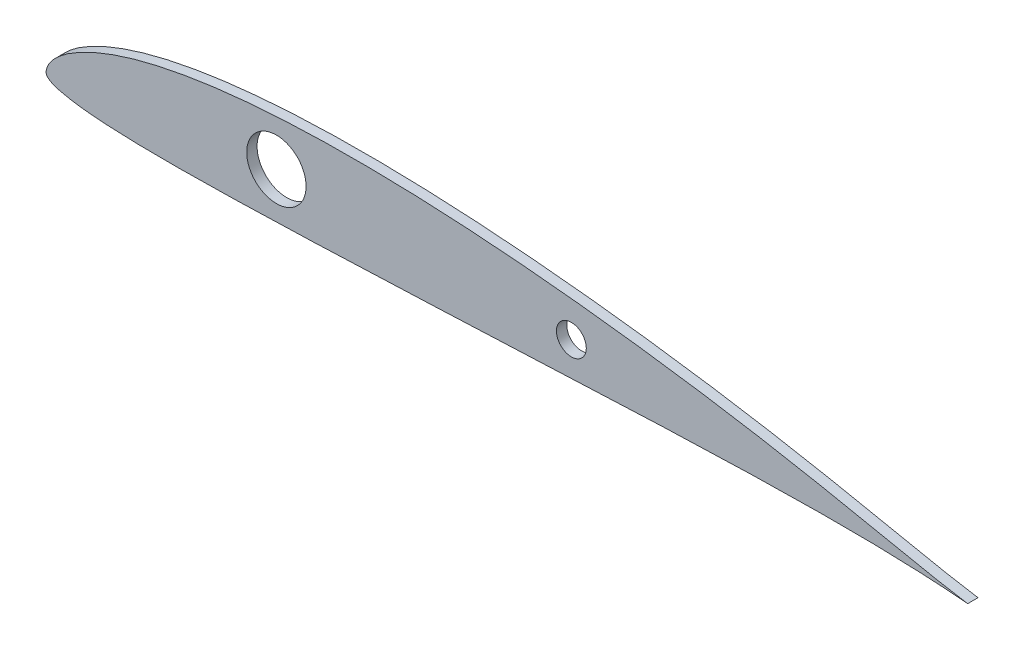
from build123d import *

# Parameters (mm, degrees)
SKETCH_1_R      = 8.05
SKETCH_1_R_2    = 4.05
EXTRUDE_1_DEPTH = 1.4


with BuildPart() as part:
    # Эскиз1 → Бобышка-Вытянуть1 (new, symmetric)
    with BuildSketch(Plane.XY):
        with BuildLine():
            add(Edge.make_bspline(
                [(0, 0), (0.018871718, -0.191458654), (0.095089169, -0.964705177), (1.706152902, -2.107027665), (4.500087477, -2.851769067), (8.687459942, -3.644061995), (14.135657503, -4.15912967), (20.848112012, -4.523549846), (28.752907792, -4.688514126), (37.779795609, -4.689041954), (47.837831161, -4.538039503), (58.820306374, -4.251921588), (70.60679251, -3.868608025), (83.06010153, -3.409033778), (96.035635701, -2.879346251), (109.387239837, -2.306383388), (122.965978931, -1.694860333), (136.622137743, -1.073639089), (150.199115392, -0.470922151), (163.53658295, 0.076551628), (176.471135172, 0.566798188), (188.841099972, 0.957639353), (200.483907746, 1.228143059), (211.234601881, 1.358189011), (220.926690721, 1.347697775), (229.39612438, 1.180923212), (236.49675891, 0.917479418), (242.114506532, 0.607102556), (246.175281813, 0.33307026), (248.628885905, 0.125433469), (249.725014491, 0.025156467), (250, 0)],
                knots=[0, 0, 0, 0, 0.002249682, 0.00908582, 0.020842106, 0.037635477, 0.059467466, 0.086252011, 0.117796132, 0.153826565, 0.193968214, 0.237839145, 0.284932658, 0.334700791, 0.386556231, 0.439909987, 0.494183894, 0.548767569, 0.603049647, 0.656369422, 0.708069227, 0.757519447, 0.804063608, 0.847048373, 0.88582367, 0.91972266, 0.948135678, 0.970615183, 0.986864288, 0.996704647, 1, 1, 1, 1], degree=3))
            add(Edge.make_bspline(
                [(250, 0), (249.728268944, 0.039573403), (248.652871383, 0.196188336), (246.279462903, 0.587177037), (242.428352959, 1.288360809), (237.222865341, 2.309386038), (230.793827799, 3.623444219), (223.269926583, 5.171874609), (214.774490127, 6.895172568), (205.42146764, 8.714760581), (195.315832501, 10.557958922), (184.559706128, 12.367831659), (173.257486693, 14.098275825), (161.523700661, 15.718292983), (149.477836757, 17.191140895), (137.244702141, 18.489945542), (124.948445657, 19.576972699), (112.713330041, 20.423484935), (100.660093739, 21.0051416), (88.90263645, 21.29794381), (77.55000993, 21.289164114), (66.705214259, 20.964670685), (56.462895388, 20.320583614), (46.904588499, 19.355972032), (38.102679916, 18.064146226), (30.116269619, 16.50245056), (22.997877518, 14.677376208), (16.795613257, 12.610458157), (11.527567398, 10.390923155), (7.227335291, 8.085166418), (3.899950905, 5.771078051), (1.601065908, 3.503870395), (0.335220365, 1.556233861), (0.081503465, 0.378373349), (0, 0)],
                knots=[0, 0, 0, 0, 0.003200295, 0.012665426, 0.028031529, 0.048819787, 0.074487746, 0.104508209, 0.138345414, 0.1755145, 0.215555464, 0.25806197, 0.302630363, 0.348808108, 0.396106186, 0.444059496, 0.492174764, 0.539964556, 0.586986035, 0.632802121, 0.677021564, 0.719279722, 0.759229813, 0.796603314, 0.83121054, 0.862874453, 0.89140365, 0.916793752, 0.939002545, 0.957938568, 0.973592366, 0.986016263, 0.995507895, 1, 1, 1, 1], degree=3))
        make_face()
        with Locations((62.5, 8.277885291)):
            Circle(SKETCH_1_R, mode=Mode.SUBTRACT)
        with Locations((142.5, 8.277885291)):
            Circle(SKETCH_1_R_2, mode=Mode.SUBTRACT)
    extrude(amount=EXTRUDE_1_DEPTH, both=True)


solid = part.part
